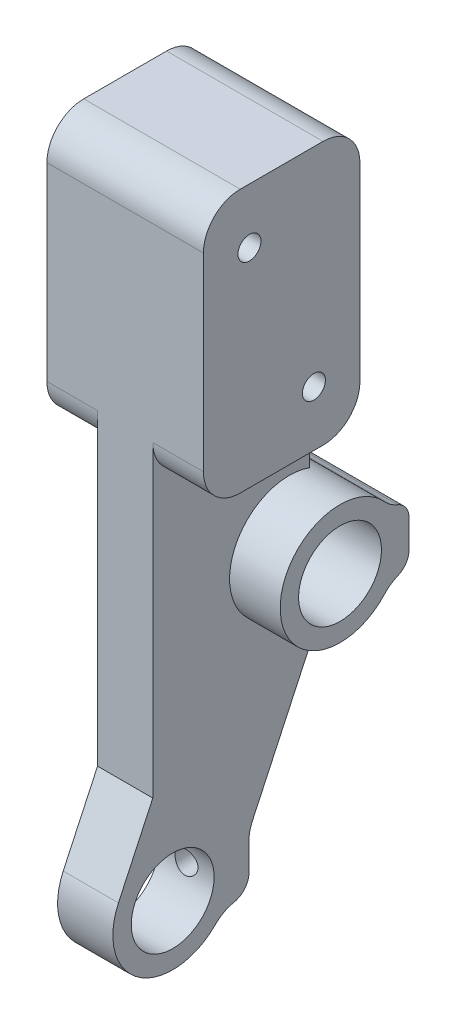
from build123d import *

# Parameters (mm, degrees)
BOSS_EXTRUDE1_DEPTH       = 3
BOSS_EXTRUDE1_DEPTH_BACK  = 3
SKETCH2_R                 = 4.5
BOSS_EXTRUDE4_START       = -8.5
SKETCH2_6_R               = 6.5
SKETCH2_6_R_2             = 4.5
BOSS_EXTRUDE4_DEPTH       = 17
BOSS_EXTRUDE2_DEPTH       = 8.5
BOSS_EXTRUDE2_DEPTH_BACK  = 8.5
M2_TAPPED_HOLE1_REACH     = 63.876
M2_TAPPED_HOLE1_BORE_R    = 1.25
M2_TAPPED_HOLE2_REACH     = 59.753
M2_TAPPED_HOLE2_BORE_R    = 1.25
M3X0_5_TAPPED_HOLE1_D     = 2.5
M3X0_5_TAPPED_HOLE1_DEPTH = 7.5
M3X0_5_TAPPED_HOLE1_TIP   = 0.751075774
M3X0_5_TAPPED_HOLE2_D     = 2.5
M3X0_5_TAPPED_HOLE2_DEPTH = 7.5
M3X0_5_TAPPED_HOLE2_TIP   = 0.751075774


with BuildPart() as part:
    # Sketch2 → Boss-Extrude1 (new, two sides: drawn at the far end of the back side and taken through both)
    with BuildSketch(Plane(origin=(0, 0, 0), x_dir=(0, 0, -1), z_dir=(1, 0, 0)).offset(-BOSS_EXTRUDE1_DEPTH_BACK)):
        with BuildLine():
            ThreePointArc((0.33951151, -17.055452752), (1.492864746, -16.361954251), (1.94565571, -15.094616806))
            Line((1.94565571, -15.094616806), (1.94565571, -12.094616806))
            ThreePointArc((1.94565571, -12.094616806), (2.040471682, -11.22885835), (2.320424562, -10.404143759))
            Line((2.320424562, -10.404143759), (11.713700119, 9.73980068))
            ThreePointArc((11.713700119, 9.73980068), (12.140663851, 10.020732686), (12.599964806, 10.244927809))
            ThreePointArc((12.599964806, 10.244927809), (13.500806616, 10.98137419), (13.839273926, 12.094616806))
            Line((13.839273926, 12.094616806), (13.839273926, 15.094616806))
            ThreePointArc((13.839273926, 15.094616806), (13.500806616, 16.207859421), (12.599964806, 16.944305803))
            ThreePointArc((12.599964806, 16.944305803), (11.821767305, 17.370774506), (11.156747464, 17.958324943))
            ThreePointArc((11.156747464, 17.958324943), (9.9384514, 19.007187499), (8.5, 19.724972654))
            Line((8.5, 19.724972654), (8.5, 51.177740757))
            ThreePointArc((8.5, 51.177740757), (7.328427125, 54.006167882), (4.5, 55.177740757))
            Line((4.5, 55.177740757), (-4.5, 55.177740757))
            ThreePointArc((-4.5, 55.177740757), (-7.328427125, 54.006167882), (-8.5, 51.177740757))
            Line((-8.5, 51.177740757), (-8.5, -2.847998534))
            Line((-8.5, -2.847998534), (-12.230274542, -10.847598104))
            ThreePointArc((-12.230274542, -10.847598104), (-10.052447802, -18.929627561), (-1.717156713, -18.164740706))
            ThreePointArc((-1.717156713, -18.164740706), (-0.771632326, -17.45656389), (0.33951151, -17.055452752))
        make_face()
        with Locations((-6.339273926, -13.594616806)):
            Circle(SKETCH2_R, mode=Mode.SUBTRACT)
        with Locations((6.339273926, 13.594616806)):
            Circle(SKETCH2_R, mode=Mode.SUBTRACT)
    extrude(amount=BOSS_EXTRUDE1_DEPTH + BOSS_EXTRUDE1_DEPTH_BACK)

    # Sketch2<6> → Boss-Extrude4 (add)
    # profile 1 of 2: a face of its own
    with BuildSketch(Plane(origin=(0, 0, 0), x_dir=(0, 0, -1), z_dir=(1, 0, 0)).offset(BOSS_EXTRUDE4_START)):
        with BuildLine():
            ThreePointArc((11.156747464, 9.230908668), (11.423199363, 9.498514711), (11.713700119, 9.73980068))
            ThreePointArc((11.713700119, 9.73980068), (12.140663851, 10.020732686), (12.599964806, 10.244927809))
            ThreePointArc((12.599964806, 10.244927809), (13.500806616, 10.98137419), (13.839273926, 12.094616806))
            Line((13.839273926, 12.094616806), (13.839273926, 15.094616806))
            ThreePointArc((13.839273926, 15.094616806), (13.500806616, 16.207859421), (12.599964806, 16.944305803))
            ThreePointArc((12.599964806, 16.944305803), (11.821767305, 17.370774506), (11.156747464, 17.958324943))
            ThreePointArc((11.156747464, 17.958324943), (12.404073098, 15.933037427), (12.839273926, 13.594616806))
            ThreePointArc((12.839273926, 13.594616806), (12.404073098, 11.256196185), (11.156747464, 9.230908668))
        make_face()
    # profile 2 of 2: a face of its own
    with BuildSketch(Plane(origin=(0, 0, 0), x_dir=(0, 0, -1), z_dir=(1, 0, 0)).offset(BOSS_EXTRUDE4_START)):
        with Locations((6.339273926, 13.594616806)):
            Circle(SKETCH2_6_R)
        with Locations((6.339273926, 13.594616806)):
            Circle(SKETCH2_6_R_2, mode=Mode.SUBTRACT)
    extrude(amount=BOSS_EXTRUDE4_DEPTH)

    # Sketch2<4> → Boss-Extrude2 (add, two sides: drawn at the far end of the back side and taken through both)
    with BuildSketch(Plane(origin=(0, 0, 0), x_dir=(0, 0, -1), z_dir=(1, 0, 0)).offset(-BOSS_EXTRUDE2_DEPTH_BACK)):
        with BuildLine():
            Line((-8.5, 51.177740757), (-8.5, 30.594616806))
            ThreePointArc((-8.5, 30.594616806), (-7.328427125, 27.766189681), (-4.5, 26.594616806))
            Line((-4.5, 26.594616806), (4.5, 26.594616806))
            ThreePointArc((4.5, 26.594616806), (7.328427125, 27.766189681), (8.5, 30.594616806))
            Line((8.5, 30.594616806), (8.5, 51.177740757))
            ThreePointArc((8.5, 51.177740757), (7.328427125, 54.006167882), (4.5, 55.177740757))
            Line((4.5, 55.177740757), (-4.5, 55.177740757))
            ThreePointArc((-4.5, 55.177740757), (-7.328427125, 54.006167882), (-8.5, 51.177740757))
        make_face()
    extrude(amount=BOSS_EXTRUDE2_DEPTH + BOSS_EXTRUDE2_DEPTH_BACK)

    # M2 Tapped Hole1 bore → M2 Tapped Hole1 (cut, up to next)
    with BuildSketch(Plane(origin=(0, 0, -13.839273926), x_dir=(-1, 0, 0), z_dir=(0, 0, -1)), mode=Mode.PRIVATE) as m2_tapped_hole1_sk1:
        with Locations((0, 13.594616806)):
            Circle(M2_TAPPED_HOLE1_BORE_R)
    m2_tapped_hole1_tool1 = extrude(m2_tapped_hole1_sk1.sketch, amount=-M2_TAPPED_HOLE1_REACH, mode=Mode.PRIVATE) & part.part
    add(m2_tapped_hole1_tool1.solids().sort_by_distance((0, 13.594617, -13.839274))[0], mode=Mode.SUBTRACT)

    # M2 Tapped Hole2 bore → M2 Tapped Hole2 (cut, up to next)
    with BuildSketch(Plane(origin=(0, 0, -1.94565571), x_dir=(-1, 0, 0), z_dir=(0, 0, -1)), mode=Mode.PRIVATE) as m2_tapped_hole2_sk1:
        with Locations((0, -13.594616806)):
            Circle(M2_TAPPED_HOLE2_BORE_R)
    m2_tapped_hole2_tool1 = extrude(m2_tapped_hole2_sk1.sketch, amount=-M2_TAPPED_HOLE2_REACH, mode=Mode.PRIVATE) & part.part
    add(m2_tapped_hole2_tool1.solids().sort_by_distance((0, -13.594617, -1.945656))[0], mode=Mode.SUBTRACT)

    # M3x0.5 Tapped Hole1
    with Locations(Plane.ZY.offset(8.5)):
        with Locations((-3.5, 49.177740757), (3.5, 32.594616806)):
            Hole(M3X0_5_TAPPED_HOLE1_D / 2, depth=M3X0_5_TAPPED_HOLE1_DEPTH)
            with Locations((0, 0, -(M3X0_5_TAPPED_HOLE1_DEPTH + M3X0_5_TAPPED_HOLE1_TIP / 2))):  # 118° drill point
                Cone(0, M3X0_5_TAPPED_HOLE1_D / 2, M3X0_5_TAPPED_HOLE1_TIP, mode=Mode.SUBTRACT)

    # M3x0.5 Tapped Hole2
    with Locations(Plane(origin=(8.5, 0, 0), x_dir=(0, 0, -1), z_dir=(1, 0, 0))):
        with Locations((-3.5, 49.177740757), (3.5, 32.594616806)):
            Hole(M3X0_5_TAPPED_HOLE2_D / 2, depth=M3X0_5_TAPPED_HOLE2_DEPTH)
            with Locations((0, 0, -(M3X0_5_TAPPED_HOLE2_DEPTH + M3X0_5_TAPPED_HOLE2_TIP / 2))):  # 118° drill point
                Cone(0, M3X0_5_TAPPED_HOLE2_D / 2, M3X0_5_TAPPED_HOLE2_TIP, mode=Mode.SUBTRACT)


solid = part.part
